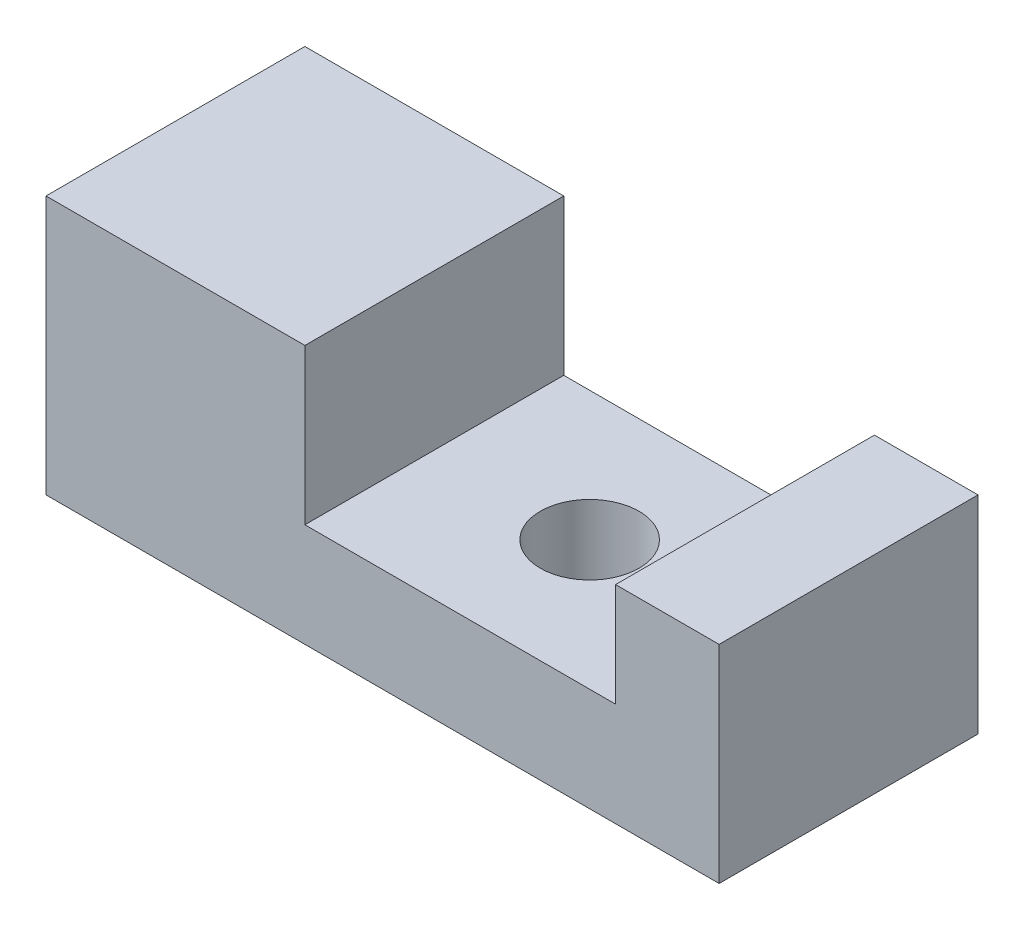
from build123d import *

# Parameters (mm, degrees)
BOSS_EXTRUDE1_DEPTH = 25
SKETCH5_R           = 9.536990003
CUT_EXTRUDE1_DEPTH  = 136.738719605


with BuildPart() as part:
    # Sketch1 → Boss-Extrude1 (new, symmetric)
    with BuildSketch(Plane.XY):
        Polygon((0, 0), (0, 50), (50, 50), (50, 20), (110, 20), (110, 40), (130, 40), (130, 0), align=None)
    extrude(amount=BOSS_EXTRUDE1_DEPTH, both=True)

    # Sketch5 → Cut-Extrude1 (cut, through all)
    with BuildSketch(Plane(origin=(0, 20, 0), x_dir=(1, 0, 0), z_dir=(0, 1, 0))):
        with Locations(Location((80, 0, 0), (0, 0, 270))):
            Circle(SKETCH5_R)
    extrude(amount=-CUT_EXTRUDE1_DEPTH, mode=Mode.SUBTRACT)


solid = part.part
